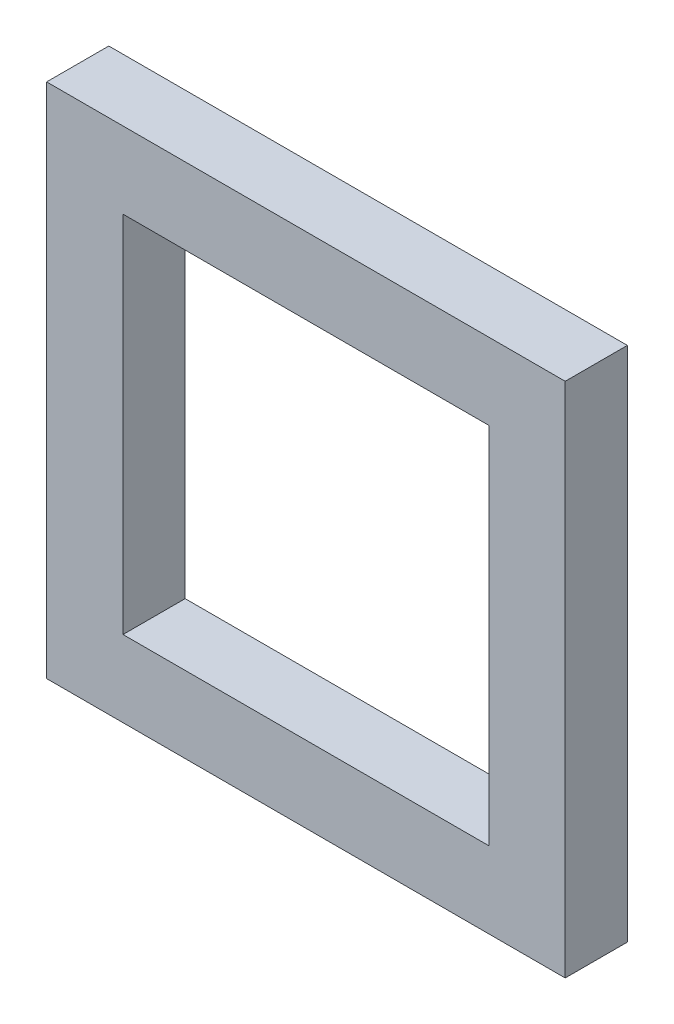
from build123d import *

# Parameters (mm, degrees)
SKETCH1_W             = 57.404
SKETCH1_H             = 57.15
SKETCH1_W_2           = 52.324
SKETCH1_H_2           = 52.07
BOSS_EXTRUDE1_DEPTH   = 6.35
SKETCH1_W_3           = 74.168
SKETCH1_H_3           = 73.914
BOSS_EXTRUDE1_2_DEPTH = 6.35
SKETCH2_W             = 74.168
SKETCH2_H             = 73.914
SKETCH2_W_2           = 52.324
SKETCH2_H_2           = 52.07
BOSS_EXTRUDE2_DEPTH   = 2.54


with BuildPart() as part:
    # Sketch1 → Boss-Extrude1 (new body)
    with BuildSketch(Plane.XY):
        with Locations((32.004, 31.877)):
            Rectangle(SKETCH1_W, SKETCH1_H)
        with Locations((32.004, 31.877)):
            Rectangle(SKETCH1_W_2, SKETCH1_H_2, mode=Mode.SUBTRACT)
    extrude(amount=BOSS_EXTRUDE1_DEPTH)



with BuildPart() as body_2:
    # Sketch1 → Boss-Extrude1 2 (new body)
    with BuildSketch(Plane.XY):
        with Locations((32.004, 31.877)):
            Rectangle(SKETCH1_W_3, SKETCH1_H_3)
        Polygon((0, 0), (64.008, 0), (64.008, 63.754), (60.706, 63.754), (3.302, 63.754), (0, 63.754), align=None, mode=Mode.SUBTRACT)
    extrude(amount=BOSS_EXTRUDE1_2_DEPTH)


with BuildPart() as part_1:
    add(part.part)

    add(body_2.part)  # Boss-Extrude2 merges body 2
    # Sketch2 → Boss-Extrude2 (add)
    with BuildSketch(Plane.XY.offset(6.35)):
        with Locations((32.004, 31.877)):
            Rectangle(SKETCH2_W, SKETCH2_H)
        with Locations((32.004, 31.877)):
            Rectangle(SKETCH2_W_2, SKETCH2_H_2, mode=Mode.SUBTRACT)
    extrude(amount=BOSS_EXTRUDE2_DEPTH)


solid = part_1.part
